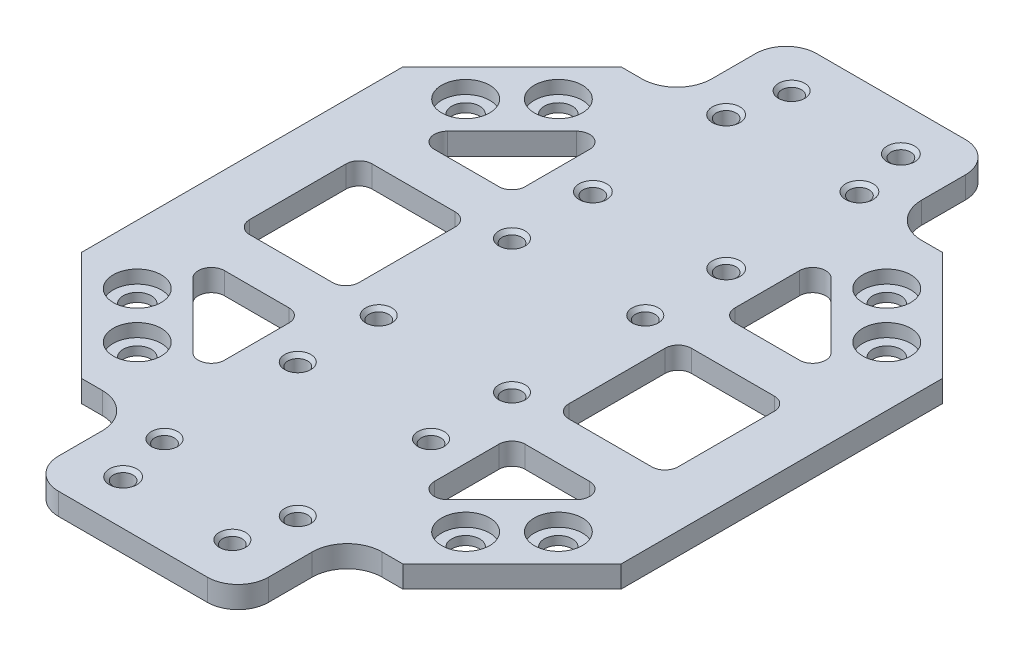
from build123d import *
from OCP.BRepFilletAPI import BRepFilletAPI_MakeChamfer

# Parameters (mm, degrees)
SKETCH2_W           = 48.044155878
SKETCH2_H           = 25
SKETCH2_R           = 2.25
BOSS_EXTRUDE2_DEPTH = 5
FILLET1_R           = 8
FILLET2_R           = 7
SKETCH5_R           = 3.2
CUT_EXTRUDE2_DEPTH  = 5
CHAMFER1_SIZE       = 0.75
CHAMFER1_SIZE2      = 0.893815194
SKETCH7_R           = 5.5
CUT_EXTRUDE4_DEPTH  = 3
SKETCH8_R           = 2.25
CUT_EXTRUDE5_DEPTH  = 10
SKETCH9_W           = 25
SKETCH9_H           = 28.044155878
CUT_EXTRUDE7_DEPTH  = 10
FILLET3_R           = 3
CHAMFER2_SIZE       = 0.75
CHAMFER2_SIZE2      = 0.893815194


with BuildPart() as part:
    # Sketch2 → Boss-Extrude2 (new body)
    # profile 1 of 7: a face of its own
    with BuildSketch(Plane(origin=(0, 0, 0), x_dir=(1, 0, 0), z_dir=(0, 1, 0))):
        Polygon((-24.022077939, -49.022077939), (-36.75, -61.75), (-24.022077939, -61.75), (24.022077939, -61.75), (36.75, -61.75), (24.022077939, -49.022077939), (49.022077939, -24.022077939), (61.75, -36.75), (61.75, 36.75), (49.022077939, 24.022077939), (24.022077939, 49.022077939), (36.75, 61.75), (24.022077939, 61.75), (-24.022077939, 61.75), (-36.75, 61.75), (-24.022077939, 49.022077939), (-49.022077939, 24.022077939), (-61.75, 36.75), (-61.75, -36.75), (-49.022077939, -24.022077939), align=None)
    # profile 2 of 7: a face of its own
    with BuildSketch(Plane(origin=(0, 0, 0), x_dir=(1, 0, 0), z_dir=(0, 1, 0))):
        with Locations((0, -74.25)):
            Rectangle(SKETCH2_W, SKETCH2_H)
        with Locations(Location((-12.5, -76.5, 0), (0, 0, 270))):
            Circle(SKETCH2_R, mode=Mode.SUBTRACT)
        with Locations(Location((12.5, -76.5, 0), (0, 0, 270))):
            Circle(SKETCH2_R, mode=Mode.SUBTRACT)
    # profile 3 of 7: a face of its own
    with BuildSketch(Plane(origin=(0, 0, 0), x_dir=(1, 0, 0), z_dir=(0, 1, 0))):
        Polygon((-36.75, -61.75), (-24.022077939, -49.022077939), (-49.022077939, -24.022077939), (-61.75, -36.75), align=None)
    # profile 4 of 7: a face of its own
    with BuildSketch(Plane(origin=(0, 0, 0), x_dir=(1, 0, 0), z_dir=(0, 1, 0))):
        Polygon((-61.75, 36.75), (-36.75, 61.75), (-24.022077939, 49.022077939), (-49.022077939, 24.022077939), align=None)
    # profile 5 of 7: a face of its own
    with BuildSketch(Plane(origin=(0, 0, 0), x_dir=(1, 0, 0), z_dir=(0, 1, 0))):
        Polygon((36.75, 61.75), (61.75, 36.75), (49.022077939, 24.022077939), (24.022077939, 49.022077939), align=None)
    # profile 6 of 7: a face of its own
    with BuildSketch(Plane(origin=(0, 0, 0), x_dir=(1, 0, 0), z_dir=(0, 1, 0))):
        Polygon((61.75, -36.75), (36.75, -61.75), (24.022077939, -49.022077939), (49.022077939, -24.022077939), align=None)
    # profile 7 of 7: a face of its own
    with BuildSketch(Plane(origin=(0, 0, 0), x_dir=(1, 0, 0), z_dir=(0, 1, 0))):
        with Locations((0, 74.25)):
            Rectangle(SKETCH2_W, SKETCH2_H)
        with Locations(Location((-12.5, 76.5, 0), (0, 0, 270))):
            Circle(SKETCH2_R, mode=Mode.SUBTRACT)
        with Locations(Location((12.5, 76.5, 0), (0, 0, 270))):
            Circle(SKETCH2_R, mode=Mode.SUBTRACT)
    extrude(amount=BOSS_EXTRUDE2_DEPTH)

    # Fillet1
    fillet1_edges = [part.edges().sort_by_distance(p)[0] for p in [
        (24.022077939, 2.5, 61.75),
        (-24.022077939, 2.5, 61.75),
        (-24.022077939, 2.5, -61.75),
        (24.022077939, 2.5, -61.75),
    ]]
    fillet(fillet1_edges, radius=FILLET1_R)

    # Fillet2
    fillet2_edges = [part.edges().sort_by_distance(p)[0] for p in [
        (24.022077939, 2.5, 86.75),
        (-24.022077939, 2.5, 86.75),
        (-24.022077939, 2.5, -86.75),
        (24.022077939, 2.5, -86.75),
    ]]
    fillet(fillet2_edges, radius=FILLET2_R)

    # Sketch5 → Cut-Extrude2 (cut)
    with BuildSketch(Plane.XZ):
        with Locations(Location((-37.58273811, 48.189339828, 0), (0, 0, 270))):
            Circle(SKETCH5_R)
        with Locations(Location((-48.189339828, 37.58273811, 0), (0, 0, 270))):
            Circle(SKETCH5_R)
        with Locations(Location((48.189339828, 37.58273811, 0), (0, 0, 270))):
            Circle(SKETCH5_R)
        with Locations(Location((37.58273811, 48.189339828, 0), (0, 0, 270))):
            Circle(SKETCH5_R)
        with Locations(Location((48.189339828, -37.58273811, 0), (0, 0, 270))):
            Circle(SKETCH5_R)
        with Locations(Location((37.58273811, -48.189339828, 0), (0, 0, 270))):
            Circle(SKETCH5_R)
        with Locations(Location((-37.58273811, -48.189339828, 0), (0, 0, 270))):
            Circle(SKETCH5_R)
        with Locations(Location((-48.189339828, -37.58273811, 0), (0, 0, 270))):
            Circle(SKETCH5_R)
    extrude(amount=-CUT_EXTRUDE2_DEPTH, mode=Mode.SUBTRACT)

    # Chamfer1: one chamfer whose edges measure the first distance from different faces: ONE call of the kernel's chamfer builder (chamfer() names one face for all edges)
    chamfer1_edges_1 = [part.edges().sort_by_distance(p)[0] for p in [
        (12.5, 5, 74.25),
        (-12.5, 5, -78.75),
    ]]
    chamfer1_side_1 = [part.faces().sort_by_distance(p)[0] for p in [
        (0, 5, 0),
    ]]
    chamfer1_edges_2 = [part.edges().sort_by_distance(p)[0] for p in [
        (-12.5, 5, 74.25),
    ]]
    chamfer1_side_2 = [part.faces().sort_by_distance(p)[0] for p in [
        (-12.5, 2.5, 74.25),
    ]]
    chamfer1_edges_3 = [part.edges().sort_by_distance(p)[0] for p in [
        (12.5, 5, -78.75),
    ]]
    chamfer1_side_3 = [part.faces().sort_by_distance(p)[0] for p in [
        (12.5, 2.5, -78.75),
    ]]
    chamfer1 = BRepFilletAPI_MakeChamfer(part.part.solid().wrapped)
    for e in chamfer1_edges_1:
        chamfer1.Add(CHAMFER1_SIZE, CHAMFER1_SIZE2, e.wrapped, chamfer1_side_1[0].wrapped)  # the first distance lies on this face
    for e in chamfer1_edges_2:
        chamfer1.Add(CHAMFER1_SIZE, CHAMFER1_SIZE2, e.wrapped, chamfer1_side_2[0].wrapped)  # the first distance lies on this face
    for e in chamfer1_edges_3:
        chamfer1.Add(CHAMFER1_SIZE, CHAMFER1_SIZE2, e.wrapped, chamfer1_side_3[0].wrapped)  # the first distance lies on this face
    add(Compound.cast(chamfer1.Shape()), mode=Mode.REPLACE)

    # Sketch7 → Cut-Extrude4 (cut)
    with BuildSketch(Plane(origin=(0, 5, 0), x_dir=(1, 0, 0), z_dir=(0, 1, 0))):
        with Locations(Location((-37.58273811, 48.189339828, 0), (0, 0, 270))):
            Circle(SKETCH7_R)
        with Locations(Location((-48.189339828, 37.58273811, 0), (0, 0, 270))):
            Circle(SKETCH7_R)
        with Locations(Location((37.58273811, 48.189339828, 0), (0, 0, 270))):
            Circle(SKETCH7_R)
        with Locations(Location((48.189339828, 37.58273811, 0), (0, 0, 270))):
            Circle(SKETCH7_R)
        with Locations(Location((48.189339828, -37.58273811, 0), (0, 0, 270))):
            Circle(SKETCH7_R)
        with Locations(Location((37.58273811, -48.189339828, 0), (0, 0, 270))):
            Circle(SKETCH7_R)
        with Locations(Location((-37.58273811, -48.189339828, 0), (0, 0, 270))):
            Circle(SKETCH7_R)
        with Locations(Location((-48.189339828, -37.58273811, 0), (0, 0, 270))):
            Circle(SKETCH7_R)
    extrude(amount=-CUT_EXTRUDE4_DEPTH, mode=Mode.SUBTRACT)

    # Sketch8 → Cut-Extrude5 (cut)
    with BuildSketch(Plane(origin=(0, 5, 0), x_dir=(1, 0, 0), z_dir=(0, 1, 0))):
        with BuildLine():
            ThreePointArc((17.487775133, -33.772077939), (15.237775133, -31.522077939), (12.987775133, -33.772077939))
            Line((12.987775133, -33.772077939), (15.237775133, -33.772077939))
            Line((15.237775133, -33.772077939), (15.237775133, -36.022077939))
            ThreePointArc((15.237775133, -36.022077939), (16.82876539, -35.363068196), (17.487775133, -33.772077939))
        make_face()
        with BuildLine():
            Line((15.237775133, -33.772077939), (12.987775133, -33.772077939))
            ThreePointArc((12.987775133, -33.772077939), (13.646784875, -35.363068196), (15.237775133, -36.022077939))
            Line((15.237775133, -36.022077939), (15.237775133, -33.772077939))
        make_face()
        with BuildLine():
            ThreePointArc((-15.262224867, -36.022077939), (-13.67123461, -35.363068196), (-13.012224867, -33.772077939))
            Line((-13.012224867, -33.772077939), (-15.262224867, -33.772077939))
            Line((-15.262224867, -33.772077939), (-15.262224867, -36.022077939))
        make_face()
        with BuildLine():
            Line((-15.262224867, -33.772077939), (-13.012224867, -33.772077939))
            ThreePointArc((-13.012224867, -33.772077939), (-16.853215125, -32.181087681), (-15.262224867, -36.022077939))
            Line((-15.262224867, -36.022077939), (-15.262224867, -33.772077939))
        make_face()
        with BuildLine():
            ThreePointArc((-13.012224867, -64.272077939), (-13.67123461, -62.681087681), (-15.262224867, -62.022077939))
            Line((-15.262224867, -62.022077939), (-15.262224867, -64.272077939))
            Line((-15.262224867, -64.272077939), (-13.012224867, -64.272077939))
        make_face()
        with BuildLine():
            Line((-15.262224867, -64.272077939), (-15.262224867, -62.022077939))
            ThreePointArc((-15.262224867, -62.022077939), (-16.853215125, -65.863068196), (-13.012224867, -64.272077939))
            Line((-13.012224867, -64.272077939), (-15.262224867, -64.272077939))
        make_face()
        with BuildLine():
            ThreePointArc((17.487775133, -64.272077939), (16.82876539, -62.681087681), (15.237775133, -62.022077939))
            Line((15.237775133, -62.022077939), (15.237775133, -64.272077939))
            Line((15.237775133, -64.272077939), (12.987775133, -64.272077939))
            ThreePointArc((12.987775133, -64.272077939), (15.237775133, -66.522077939), (17.487775133, -64.272077939))
        make_face()
        with BuildLine():
            Line((15.237775133, -64.272077939), (15.237775133, -62.022077939))
            ThreePointArc((15.237775133, -62.022077939), (13.646784875, -62.681087681), (12.987775133, -64.272077939))
            Line((12.987775133, -64.272077939), (15.237775133, -64.272077939))
        make_face()
        with BuildLine():
            ThreePointArc((17.5, -15.25), (16.840990258, -13.659009742), (15.25, -13))
            Line((15.25, -13), (15.25, -15.25))
            Line((15.25, -15.25), (13, -15.25))
            ThreePointArc((13, -15.25), (15.25, -17.5), (17.5, -15.25))
        make_face()
        with BuildLine():
            Line((15.25, -15.25), (15.25, -13))
            ThreePointArc((15.25, -13), (13.659009742, -13.659009742), (13, -15.25))
            Line((13, -15.25), (15.25, -15.25))
        make_face()
        with BuildLine():
            ThreePointArc((-13, -15.25), (-13.659009742, -13.659009742), (-15.25, -13))
            Line((-15.25, -13), (-15.25, -15.25))
            Line((-15.25, -15.25), (-13, -15.25))
        make_face()
        with BuildLine():
            Line((-15.25, -15.25), (-15.25, -13))
            ThreePointArc((-15.25, -13), (-16.840990258, -16.840990258), (-13, -15.25))
            Line((-13, -15.25), (-15.25, -15.25))
        make_face()
        with BuildLine():
            ThreePointArc((17.5, 15.25), (15.25, 17.5), (13, 15.25))
            Line((13, 15.25), (15.25, 15.25))
            Line((15.25, 15.25), (15.25, 13))
            ThreePointArc((15.25, 13), (16.840990258, 13.659009742), (17.5, 15.25))
        make_face()
        with BuildLine():
            Line((15.25, 15.25), (13, 15.25))
            ThreePointArc((13, 15.25), (13.659009742, 13.659009742), (15.25, 13))
            Line((15.25, 13), (15.25, 15.25))
        make_face()
        with BuildLine():
            ThreePointArc((-15.25, 13), (-13.659009742, 13.659009742), (-13, 15.25))
            Line((-13, 15.25), (-15.25, 15.25))
            Line((-15.25, 15.25), (-15.25, 13))
        make_face()
        with BuildLine():
            Line((-15.25, 15.25), (-13, 15.25))
            ThreePointArc((-13, 15.25), (-16.840990258, 16.840990258), (-15.25, 13))
            Line((-15.25, 13), (-15.25, 15.25))
        make_face()
        with Locations(Location((15.237775133, 64.272077939, 0), (0, 0, 270))):
            Circle(SKETCH8_R)
        with Locations(Location((15.237775133, 33.772077939, 0), (0, 0, 270))):
            Circle(SKETCH8_R)
        with Locations(Location((-15.262224867, 33.772077939, 0), (0, 0, 270))):
            Circle(SKETCH8_R)
        with Locations(Location((-15.262224867, 64.272077939, 0), (0, 0, 270))):
            Circle(SKETCH8_R)
    extrude(amount=-CUT_EXTRUDE5_DEPTH, mode=Mode.SUBTRACT)

    # Sketch9 → Cut-Extrude7 (cut)
    with BuildSketch(Plane(origin=(0, 5, 0), x_dir=(1, 0, 0), z_dir=(0, 1, 0))):
        with Locations((36.522077939, 0)):
            Rectangle(SKETCH9_W, SKETCH9_H)
        Polygon((49.022077939, -24.022077939), (24.022077939, -24.022077939), (24.022077939, -49.022077939), align=None)
        Polygon((-24.022077939, -49.022077939), (-49.022077939, -24.022077939), (-24.022077939, -24.022077939), align=None)
        with Locations((-36.522077939, 0)):
            Rectangle(SKETCH9_W, SKETCH9_H)
        Polygon((-49.022077939, 24.022077939), (-24.022077939, 49.022077939), (-24.022077939, 24.022077939), align=None)
        Polygon((24.022077939, 49.022077939), (49.022077939, 24.022077939), (24.022077939, 24.022077939), align=None)
    extrude(amount=-CUT_EXTRUDE7_DEPTH, mode=Mode.SUBTRACT)

    # Fillet3
    fillet3_edges = [part.edges().sort_by_distance(p)[0] for p in [
        (24.022077939, 2.5, 24.022077939),
        (49.022077939, 2.5, 24.022077939),
        (24.022077939, 2.5, 49.022077939),
        (-24.022077939, 2.5, 49.022077939),
        (-49.022077939, 2.5, 24.022077939),
        (-24.022077939, 2.5, 24.022077939),
        (-49.022077939, 2.5, 14.022077939),
        (-49.022077939, 2.5, -14.022077939),
        (-24.022077939, 2.5, -14.022077939),
        (-24.022077939, 2.5, 14.022077939),
        (-49.022077939, 2.5, -24.022077939),
        (-24.022077939, 2.5, -49.022077939),
        (-24.022077939, 2.5, -24.022077939),
        (24.022077939, 2.5, -49.022077939),
        (49.022077939, 2.5, -24.022077939),
        (24.022077939, 2.5, -24.022077939),
        (24.022077939, 2.5, 14.022077939),
        (24.022077939, 2.5, -14.022077939),
        (49.022077939, 2.5, -14.022077939),
        (49.022077939, 2.5, 14.022077939),
    ]]
    fillet(fillet3_edges, radius=FILLET3_R)

    # Chamfer2: one chamfer whose edges measure the first distance from different faces: ONE call of the kernel's chamfer builder (chamfer() names one face for all edges)
    chamfer2_edges_1 = [part.edges().sort_by_distance(p)[0] for p in [
        (-17.5, 5, 15.25),
        (17.5, 5, -15.25),
        (-15.25, 5, -17.5),
        (15.25, 5, 17.5),
        (15.237775133, 5, 66.522077939),
        (-17.512224867, 5, 64.272077939),
        (-15.262224867, 5, 31.522077939),
        (17.487775133, 5, 33.772077939),
    ]]
    chamfer2_side_1 = [part.faces().sort_by_distance(p)[0] for p in [
        (0.000121446, 5, 0),
    ]]
    chamfer2_edges_2 = [part.edges().sort_by_distance(p)[0] for p in [
        (15.237775133, 5, -66.522077939),
    ]]
    chamfer2_side_2 = [part.faces().sort_by_distance(p)[0] for p in [
        (15.237775133, 2.5, -66.522077939),
    ]]
    chamfer2_edges_3 = [part.edges().sort_by_distance(p)[0] for p in [
        (15.237775133, 5, -36.022077939),
    ]]
    chamfer2_side_3 = [part.faces().sort_by_distance(p)[0] for p in [
        (15.237775133, 2.5, -36.022077939),
    ]]
    chamfer2_edges_4 = [part.edges().sort_by_distance(p)[0] for p in [
        (-15.262224867, 5, -36.022077939),
    ]]
    chamfer2_side_4 = [part.faces().sort_by_distance(p)[0] for p in [
        (-15.262224867, 2.5, -36.022077939),
    ]]
    chamfer2_edges_5 = [part.edges().sort_by_distance(p)[0] for p in [
        (-15.262224867, 5, -66.522077939),
    ]]
    chamfer2_side_5 = [part.faces().sort_by_distance(p)[0] for p in [
        (-15.262224867, 2.5, -66.522077939),
    ]]
    chamfer2 = BRepFilletAPI_MakeChamfer(part.part.solid().wrapped)
    for e in chamfer2_edges_1:
        chamfer2.Add(CHAMFER2_SIZE, CHAMFER2_SIZE2, e.wrapped, chamfer2_side_1[0].wrapped)  # the first distance lies on this face
    for e in chamfer2_edges_2:
        chamfer2.Add(CHAMFER2_SIZE, CHAMFER2_SIZE2, e.wrapped, chamfer2_side_2[0].wrapped)  # the first distance lies on this face
    for e in chamfer2_edges_3:
        chamfer2.Add(CHAMFER2_SIZE, CHAMFER2_SIZE2, e.wrapped, chamfer2_side_3[0].wrapped)  # the first distance lies on this face
    for e in chamfer2_edges_4:
        chamfer2.Add(CHAMFER2_SIZE, CHAMFER2_SIZE2, e.wrapped, chamfer2_side_4[0].wrapped)  # the first distance lies on this face
    for e in chamfer2_edges_5:
        chamfer2.Add(CHAMFER2_SIZE, CHAMFER2_SIZE2, e.wrapped, chamfer2_side_5[0].wrapped)  # the first distance lies on this face
    add(Compound.cast(chamfer2.Shape()), mode=Mode.REPLACE)


solid = part.part
